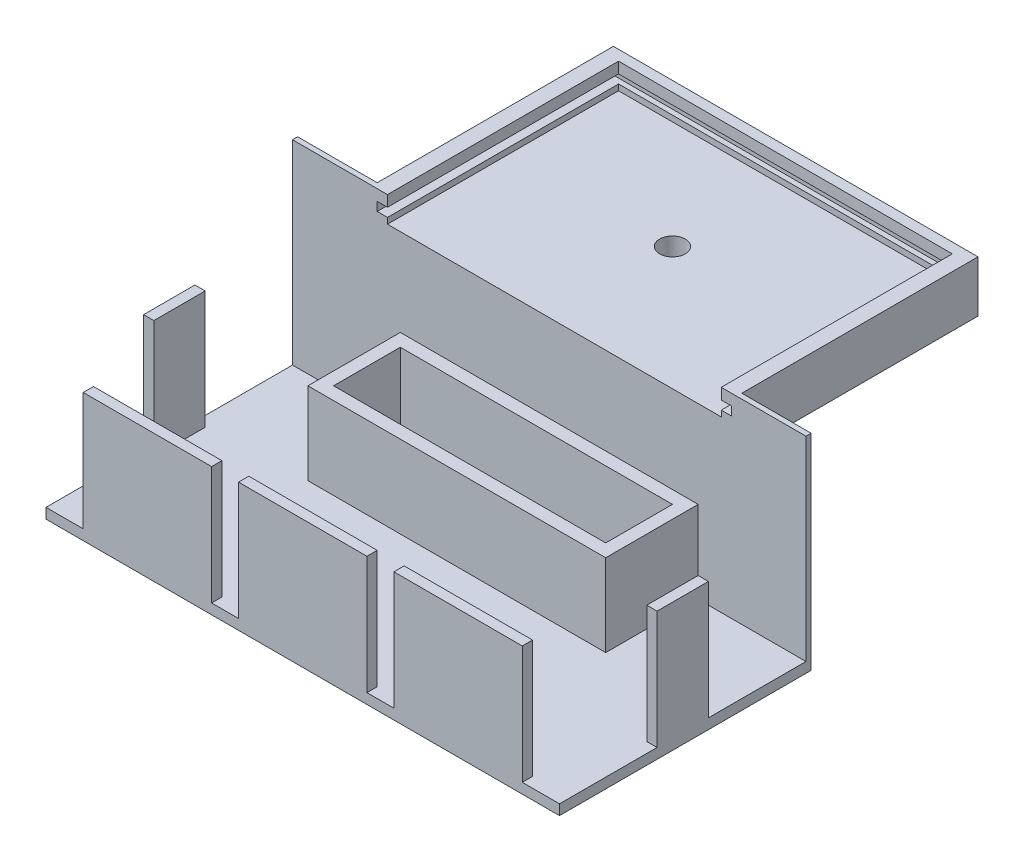
from build123d import *

# Parameters (mm, degrees)
CROQUIS1_W              = 100
CROQUIS1_H              = 95
SALIENTE_EXTRUIR1_DEPTH = 40
CROQUIS3_W              = 20
CROQUIS3_H              = 46
CORTAR_EXTRUIR1_DEPTH   = 30
CROQUIS4_W              = 96
CROQUIS4_H              = 46
CORTAR_EXTRUIR2_DEPTH   = 38
CROQUIS5_W              = 65
CROQUIS5_H              = 67
CORTAR_EXTRUIR3_DEPTH   = 5
CROQUIS7_W              = 69
CROQUIS7_H              = 1.7
CORTAR_EXTRUIR4_DEPTH   = 46
CROQUIS9_W              = 5
CROQUIS9_H              = 15
CORTAR_EXTRUIR6_DEPTH   = 10
CROQUIS10_R             = 2.5
CORTAR_EXTRUIR8_DEPTH   = 143.302494708
CROQUIS11_W             = 46
CROQUIS11_H             = 30
CORTAR_EXTRUIR9_DEPTH   = 131.479883507
CROQUIS12_W             = 13.5
CROQUIS12_H             = 46
CROQUIS12_W_2           = 15.5
CORTAR_EXTRUIR10_DEPTH  = 144.614066163
CORTAR_EXTRUIR13_DEPTH  = 2
CORTAR_EXTRUIR14_DEPTH  = 2
CORTAR_EXTRUIR15_DEPTH  = 2
CROQUIS16_W             = 58
CROQUIS16_H             = 18
SALIENTE_EXTRUIR2_DEPTH = 16
CROQUIS17_W             = 53
CROQUIS17_H             = 13
CORTAR_EXTRUIR16_DEPTH  = 16


with BuildPart() as part:
    # Croquis1 → Saliente-Extruir1 (new body)
    with BuildSketch(Plane(origin=(0, 0, 0), x_dir=(1, 0, 0), z_dir=(0, 1, 0))):
        with Locations((50, 47.5)):
            Rectangle(CROQUIS1_W, CROQUIS1_H)
    extrude(amount=SALIENTE_EXTRUIR1_DEPTH)

    # Croquis3 → Cortar-Extruir1 (cut)
    with BuildSketch(Plane.XZ):
        with Locations((90, -72)):
            Rectangle(CROQUIS3_W, CROQUIS3_H)
        with Locations((10, -72)):
            Rectangle(CROQUIS3_W, CROQUIS3_H)
    extrude(amount=-CORTAR_EXTRUIR1_DEPTH, mode=Mode.SUBTRACT)

    # Croquis4 → Cortar-Extruir2 (cut)
    with BuildSketch(Plane(origin=(0, 40, 0), x_dir=(1, 0, 0), z_dir=(0, 1, 0))):
        with Locations((50, 25)):
            Rectangle(CROQUIS4_W, CROQUIS4_H)
    extrude(amount=-CORTAR_EXTRUIR2_DEPTH, mode=Mode.SUBTRACT)

    # Croquis5 → Cortar-Extruir3 (cut)
    with BuildSketch(Plane(origin=(0, 40, 0), x_dir=(1, 0, 0), z_dir=(0, 1, 0))):
        with Locations((51, 59.5)):
            Rectangle(CROQUIS5_W, CROQUIS5_H)
    extrude(amount=-CORTAR_EXTRUIR3_DEPTH, mode=Mode.SUBTRACT)

    # Croquis7 → Cortar-Extruir4 (cut)
    with BuildSketch(Plane.XY.offset(-48)):
        with Locations((51, 37)):
            Rectangle(CROQUIS7_W, CROQUIS7_H)
    extrude(amount=-CORTAR_EXTRUIR4_DEPTH, mode=Mode.SUBTRACT)

    # Croquis9 → Cortar-Extruir6 (cut)
    with BuildSketch(Plane(origin=(0, 40, 0), x_dir=(1, 0, 0), z_dir=(0, 1, 0))):
        with Locations((8.5, 77.5)):
            Rectangle(CROQUIS9_W, CROQUIS9_H)
        with Locations((91.5, 77.5)):
            Rectangle(CROQUIS9_W, CROQUIS9_H)
    extrude(amount=-CORTAR_EXTRUIR6_DEPTH, mode=Mode.SUBTRACT)

    # Croquis10 → Cortar-Extruir8 (cut, through all)
    with BuildSketch(Plane(origin=(0, 35, 0), x_dir=(1, 0, 0), z_dir=(0, 1, 0))):
        with Locations(Location((50, 72, 0), (0, 0, 270))):
            Circle(CROQUIS10_R)
    extrude(amount=-CORTAR_EXTRUIR8_DEPTH, mode=Mode.SUBTRACT)

    # Croquis11 → Cortar-Extruir9 (cut, through all)
    with BuildSketch(Plane(origin=(80, 0, 0), x_dir=(0, 0, -1), z_dir=(1, 0, 0))):
        with Locations((72, 15)):
            Rectangle(CROQUIS11_W, CROQUIS11_H)
    extrude(amount=-CORTAR_EXTRUIR9_DEPTH, mode=Mode.SUBTRACT)

    # Croquis12 → Cortar-Extruir10 (cut, through all)
    with BuildSketch(Plane(origin=(0, 40, 0), x_dir=(1, 0, 0), z_dir=(0, 1, 0))):
        with Locations((93.25, 72)):
            Rectangle(CROQUIS12_W, CROQUIS12_H)
        with Locations((7.75, 72)):
            Rectangle(CROQUIS12_W_2, CROQUIS12_H)
    extrude(amount=-CORTAR_EXTRUIR10_DEPTH, mode=Mode.SUBTRACT)

    # Croquis14 → Cortar-Extruir13 (cut)
    with BuildSketch(Plane(origin=(100, 0, 0), x_dir=(0, 0, -1), z_dir=(1, 0, 0))):
        Polygon((19, 25), (29, 25), (29, 2), (48, 2), (48, 40), (0, 40), (0, 2), (19, 2), align=None)
    extrude(amount=-CORTAR_EXTRUIR13_DEPTH, mode=Mode.SUBTRACT)

    # Croquis15 → Cortar-Extruir14 (cut)
    with BuildSketch(Plane.ZY):
        Polygon((-48, 2), (-48, 40), (0, 40), (0, 2), (-19, 2), (-19, 25), (-29, 25), (-29, 2), align=None)
    extrude(amount=-CORTAR_EXTRUIR14_DEPTH, mode=Mode.SUBTRACT)

    # Croquis13 → Cortar-Extruir15 (cut)
    with BuildSketch(Plane.XY):
        Polygon((2, 40), (98, 40), (98, 2), (92.75, 2), (92.75, 25), (67.75, 25), (67.75, 2), (62.5, 2), (62.5, 25), (37.5, 25), (37.5, 2), (32.25, 2), (32.25, 25), (7.25, 25), (7.25, 2), (2, 2), align=None)
    extrude(amount=-CORTAR_EXTRUIR15_DEPTH, mode=Mode.SUBTRACT)

    # Croquis16 → Saliente-Extruir2 (add)
    with BuildSketch(Plane(origin=(0, 2, 0), x_dir=(1, 0, 0), z_dir=(0, 1, 0))):
        with Locations((50, 39)):
            Rectangle(CROQUIS16_W, CROQUIS16_H)
    extrude(amount=SALIENTE_EXTRUIR2_DEPTH)

    # Croquis17 → Cortar-Extruir16 (cut)
    with BuildSketch(Plane(origin=(0, 18, 0), x_dir=(1, 0, 0), z_dir=(0, 1, 0))):
        with Locations((50, 39)):
            Rectangle(CROQUIS17_W, CROQUIS17_H)
    extrude(amount=-CORTAR_EXTRUIR16_DEPTH, mode=Mode.SUBTRACT)


solid = part.part
